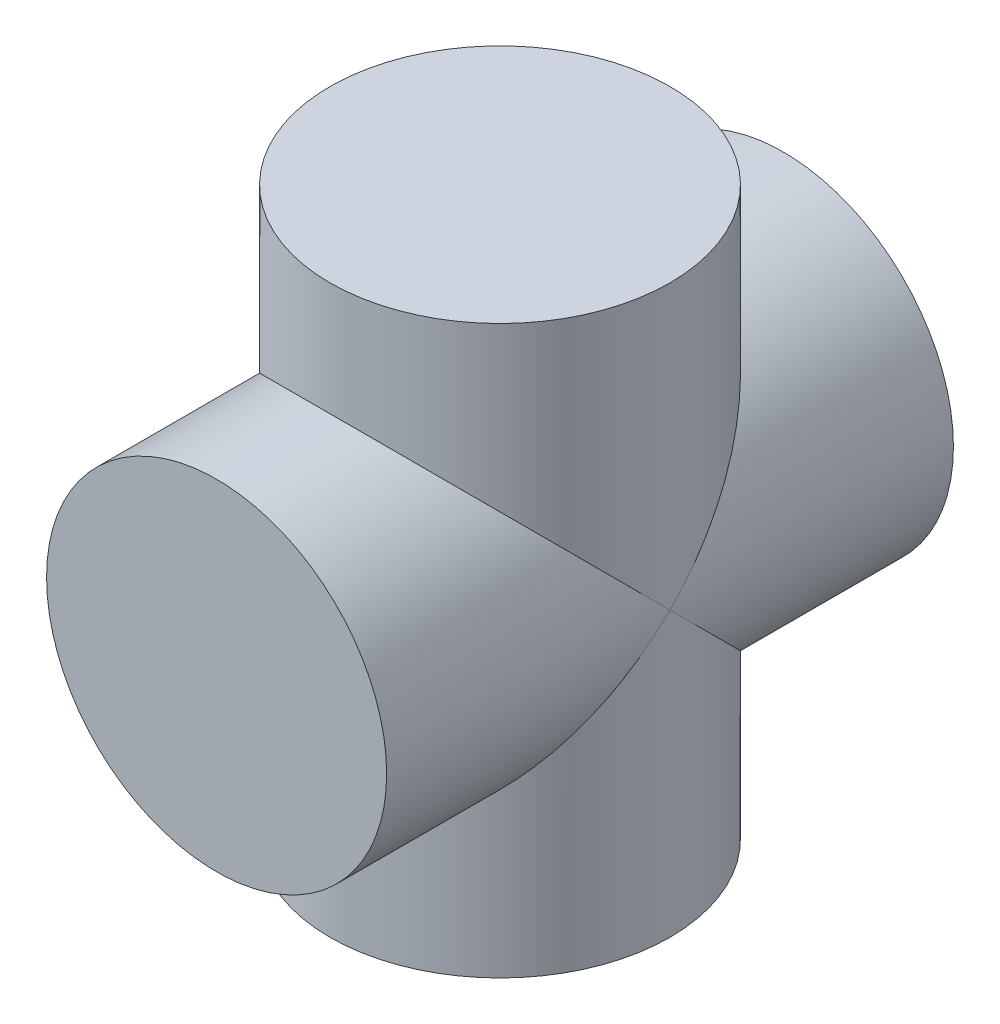
from build123d import *

# Parameters (mm, degrees)
SKETCH_1_R      = 30
EXTRUDE_1_DEPTH = 50
SKETCH_2_R      = 30
EXTRUDE_2_DEPTH = 50


with BuildPart() as part:
    # 草图1 → 凸台-拉伸1 (new, symmetric)
    with BuildSketch(Plane.XY):
        Circle(SKETCH_1_R)
    extrude(amount=EXTRUDE_1_DEPTH, both=True)

    # 草图2 → 凸台-拉伸2 (add, symmetric)
    with BuildSketch(Plane(origin=(0, 0, 0), x_dir=(1, 0, 0), z_dir=(0, 1, 0))):
        Circle(SKETCH_2_R)
    extrude(amount=EXTRUDE_2_DEPTH, both=True)


solid = part.part
